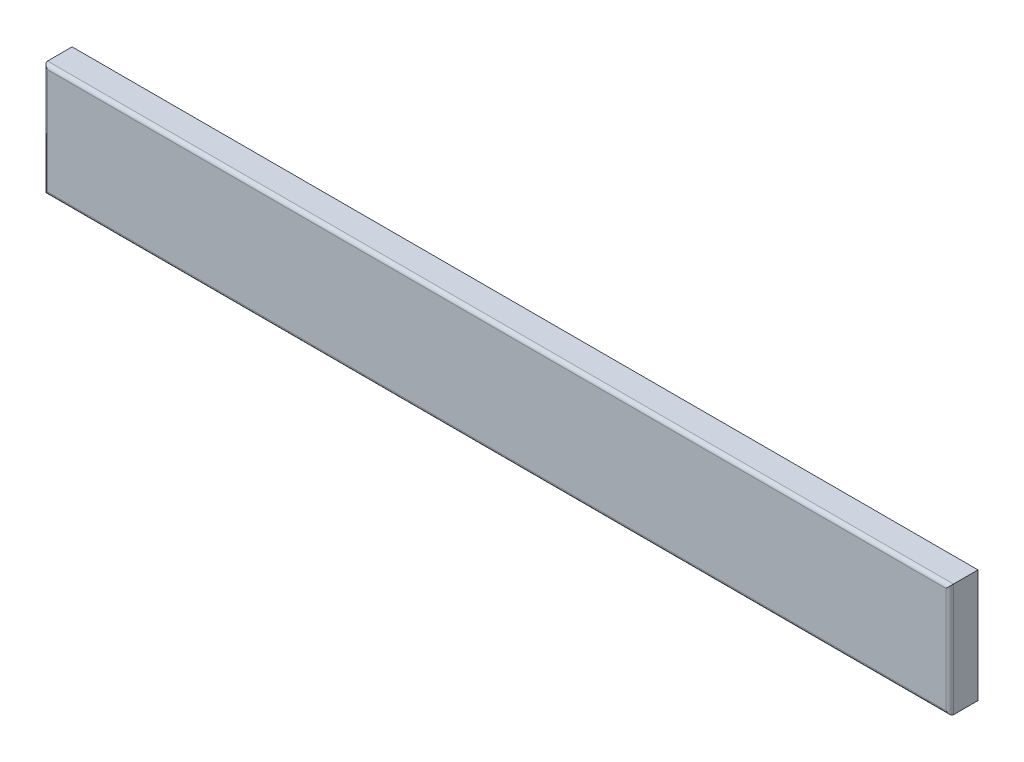
from build123d import *

# Parameters (mm, degrees)
SKETCH1_W           = 609.6
SKETCH1_H           = 76.2
BOSS_EXTRUDE1_DEPTH = 2.54
SKETCH2_W           = 609.6
SKETCH2_H           = 76.2
SKETCH2_W_2         = 604.52
SKETCH2_H_2         = 71.12
BOSS_EXTRUDE2_DEPTH = 19.05
FILLET1_R           = 2.54


with BuildPart() as part:
    # Sketch1 → Boss-Extrude1 (new body)
    with BuildSketch(Plane.XY):
        Rectangle(SKETCH1_W, SKETCH1_H)
    extrude(amount=BOSS_EXTRUDE1_DEPTH)

    # Sketch2 → Boss-Extrude2 (add)
    with BuildSketch(Plane.XY.offset(2.54)):
        Rectangle(SKETCH2_W, SKETCH2_H)
        Rectangle(SKETCH2_W_2, SKETCH2_H_2, mode=Mode.SUBTRACT)
    extrude(amount=-BOSS_EXTRUDE2_DEPTH)

    # Fillet1
    fillet1_edges = [part.edges().sort_by_distance(p)[0] for p in [
        (-304.8, 0, 2.54),
        (0, -38.1, 2.54),
        (304.8, 0, 2.54),
        (0, 38.1, 2.54),
    ]]
    fillet(fillet1_edges, radius=FILLET1_R)


solid = part.part
